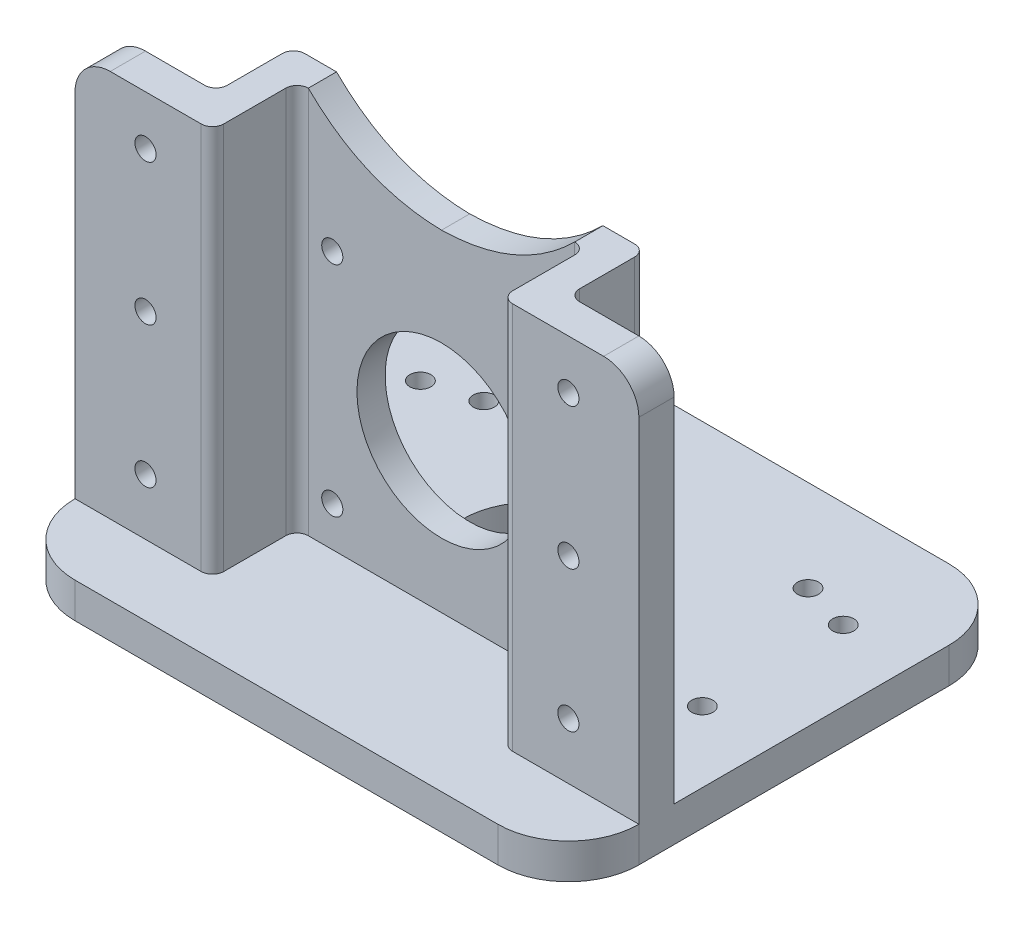
from build123d import *

# Parameters (mm, degrees)
SKETCH_1_W               = 80
SKETCH_1_H               = 70
SKETCH_1_R               = 10
SKETCH_1_R_2             = 1.5
EXTRUDE_1_DEPTH          = 5
EXTRUDE_2_DEPTH          = 55
CUT_EXTRUDE_1_DEPTH      = 60
CUT_EXTRUDE_1_DEPTH_BACK = 60
SKETCH_3_R               = 12
SKETCH_3_R_2             = 1.5
FILLET_3_R               = 1.6
SKETCH_4_R               = 1.5
CUT_EXTRUDE_2_DEPTH      = 10
SKETCH_5_W               = 80
SKETCH_5_H               = 6
CUT_EXTRUDE_3_DEPTH      = 10
FILLET_4_R               = 10
CUT_EXTRUDE_4_DEPTH      = 10
FILLET_5_R               = 5


with BuildPart() as part:
    # 草图1 → 凸台-拉伸1 (new body)
    with BuildSketch(Plane(origin=(0, 0, 0), x_dir=(1, 0, 0), z_dir=(0, 1, 0))):
        Rectangle(SKETCH_1_W, SKETCH_1_H)
        with Locations(Location((0, 0, 0), (0, 0, 270))):
            Circle(SKETCH_1_R, mode=Mode.SUBTRACT)
        with Locations(Location((23, 16, 0), (0, 0, 270))):
            Circle(SKETCH_1_R_2, mode=Mode.SUBTRACT)
        with Locations(Location((23, -6, 0), (0, 0, 90))):
            Circle(SKETCH_1_R_2, mode=Mode.SUBTRACT)
        with Locations(Location((-23, -6, 0), (0, 0, 270))):
            Circle(SKETCH_1_R_2, mode=Mode.SUBTRACT)
        with Locations(Location((-23, 16, 0), (0, 0, 90))):
            Circle(SKETCH_1_R_2, mode=Mode.SUBTRACT)
    extrude(amount=EXTRUDE_1_DEPTH)

    # 草图2 → 凸台-拉伸2 (add)
    with BuildSketch(Plane(origin=(0, 5, 0), x_dir=(1, 0, 0), z_dir=(0, 1, 0))):
        Polygon((-25, -9), (25, -9), (25, -20), (40, -20), (40, -25), (20.5, -25), (20.5, -13), (-20.5, -13), (-20.5, -25), (-40, -25), (-40, -20), (-25, -20), align=None)
    extrude(amount=EXTRUDE_2_DEPTH)

    # 草图3 → 切除-拉伸1 (cut, two sides: drawn at the far end of the back side and taken through both)
    with BuildSketch(Plane.XY.offset(13).offset(-CUT_EXTRUDE_1_DEPTH_BACK)):
        with Locations((0, 26.15)):
            Circle(SKETCH_3_R)
        with Locations((15.5, 41.65)):
            Circle(SKETCH_3_R_2)
        with Locations((15.5, 10.65)):
            Circle(SKETCH_3_R_2)
        with Locations((-15.5, 10.65)):
            Circle(SKETCH_3_R_2)
        with Locations((-15.5, 41.65)):
            Circle(SKETCH_3_R_2)
        with Locations((-30, 13)):
            Circle(SKETCH_3_R_2)
        with Locations((-30, 33)):
            Circle(SKETCH_3_R_2)
        with Locations((-30, 53)):
            Circle(SKETCH_3_R_2)
        with Locations((30, 53)):
            Circle(SKETCH_3_R_2)
        with Locations((30, 33)):
            Circle(SKETCH_3_R_2)
        with Locations((30, 13)):
            Circle(SKETCH_3_R_2)
    extrude(amount=CUT_EXTRUDE_1_DEPTH + CUT_EXTRUDE_1_DEPTH_BACK, mode=Mode.SUBTRACT)

    # 圆角3
    fillet_3_edges = [part.edges().sort_by_distance(p)[0] for p in [
        (25, 32.5, 20),
        (25, 32.5, 9),
        (-25, 32.5, 9),
        (-25, 32.5, 20),
        (-20.5, 32.5, 25),
        (-20.5, 32.5, 13),
        (20.5, 32.5, 13),
        (20.5, 32.5, 25),
    ]]
    fillet(fillet_3_edges, radius=FILLET_3_R)

    # 草图4 → 切除-拉伸2 (cut)
    with BuildSketch(Plane(origin=(0, 5, 0), x_dir=(1, 0, 0), z_dir=(0, 1, 0))):
        with Locations(Location((30, 14, 0), (0, 0, 270))):
            Circle(SKETCH_4_R)
        with Locations(Location((30, -6, 0), (0, 0, 270))):
            Circle(SKETCH_4_R)
        with Locations(Location((-30, -6, 0), (0, 0, 90))):
            Circle(SKETCH_4_R)
        with Locations(Location((-30, 14, 0), (0, 0, 90))):
            Circle(SKETCH_4_R)
    extrude(amount=-CUT_EXTRUDE_2_DEPTH, mode=Mode.SUBTRACT)

    # 草图5 → 切除-拉伸3 (cut)
    with BuildSketch(Plane(origin=(0, 5, 0), x_dir=(1, 0, 0), z_dir=(0, 1, 0))):
        with Locations((0, 32)):
            Rectangle(SKETCH_5_W, SKETCH_5_H)
    extrude(amount=-CUT_EXTRUDE_3_DEPTH, mode=Mode.SUBTRACT)

    # 圆角4
    fillet_4_edges = [part.edges().sort_by_distance(p)[0] for p in [
        (-40, 2.5, -29),
        (40, 2.5, -29),
        (40, 2.5, 35),
        (-40, 2.5, 35),
    ]]
    fillet(fillet_4_edges, radius=FILLET_4_R)

    # 草图6 → 切除-拉伸4 (cut)
    with BuildSketch(Plane.XY.offset(13)):
        with BuildLine():
            Line((18.9, 60), (-18.9, 60))
            add(Edge.make_bspline(
                [(-18.9, 60), (-11.034609478, 52.202200448), (0, 52)],
                knots=[0, 0, 0, 1, 1, 1], degree=2))
            add(Edge.make_bspline(
                [(18.9, 60), (11.034609478, 52.202200448), (0, 52)],
                knots=[0, 0, 0, 1, 1, 1], degree=2))
        make_face()
    extrude(amount=-CUT_EXTRUDE_4_DEPTH, mode=Mode.SUBTRACT)

    # 圆角5
    fillet_5_edges = [part.edges().sort_by_distance(p)[0] for p in [
        (-40, 60, 22.5),
        (40, 60, 22.5),
    ]]
    fillet(fillet_5_edges, radius=FILLET_5_R)


solid = part.part
